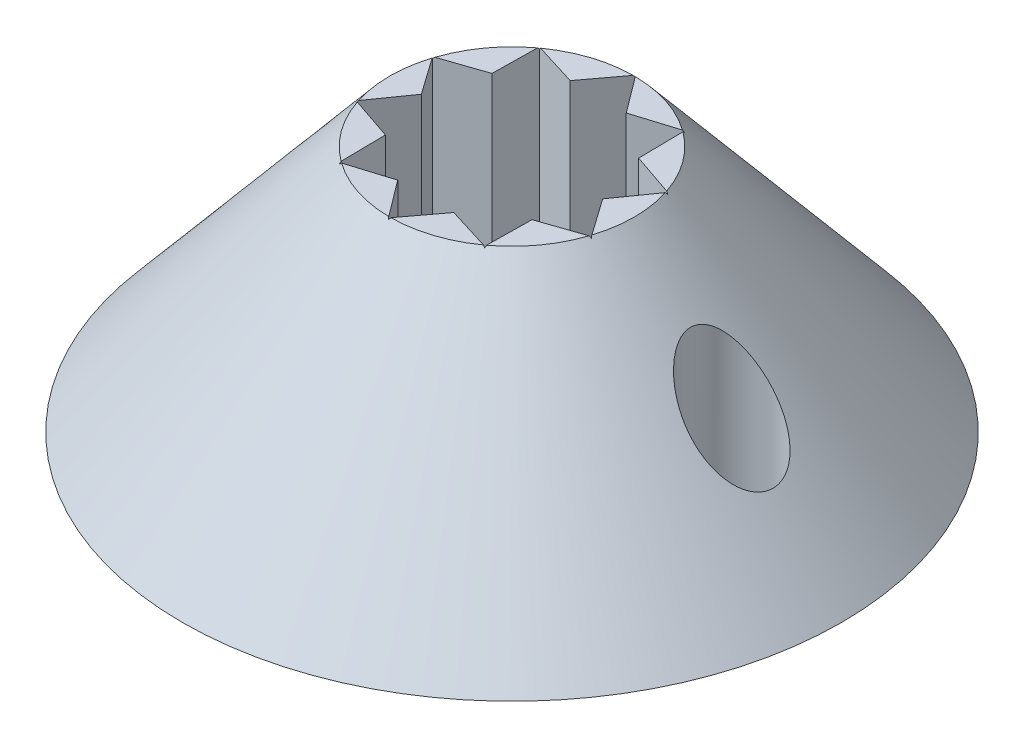
from build123d import *

# Parameters (mm, degrees)
SKETCH1_R           = 6
BOSS_EXTRUDE1_DEPTH = 4.5
BOSS_EXTRUDE1_TAPER = 40
CUT_EXTRUDE1_DEPTH  = 5
SKETCH5_R           = 0.75
CUT_EXTRUDE2_DEPTH  = 5


with BuildPart() as part:
    # Sketch1 → Boss-Extrude1 (new body)
    with BuildSketch(Plane(origin=(0, 0, 0), x_dir=(1, 0, 0), z_dir=(0, 1, 0))):
        Circle(SKETCH1_R)
    extrude(amount=BOSS_EXTRUDE1_DEPTH, taper=BOSS_EXTRUDE1_TAPER)

    # Sketch3 → Cut-Extrude1 (cut)
    with BuildSketch(Plane(origin=(0, 4.5, 0), x_dir=(1, 0, 0), z_dir=(0, 1, 0))):
        Polygon((0, 2.25), (-0.509878041, 1.569243252), (-1.322516818, 1.820288237), (-1.334878041, 0.969845666), (-2.139877162, 0.695288237), (-1.65, 0), (-2.139877162, -0.695288237), (-1.334878041, -0.969845666), (-1.322516818, -1.820288237), (-0.509878041, -1.569243252), (0, -2.25), (0.509878041, -1.569243252), (1.322516818, -1.820288237), (1.334878041, -0.969845666), (2.139877162, -0.695288237), (1.65, 0), (2.139877162, 0.695288237), (1.334878041, 0.969845666), (1.322516818, 1.820288237), (0.509878041, 1.569243252), align=None)
    extrude(amount=-CUT_EXTRUDE1_DEPTH, mode=Mode.SUBTRACT)

    # Sketch5 → Cut-Extrude2 (cut)
    with BuildSketch(Plane.XZ):
        with Locations(Location((4, 0, 0), (0, 0, 270))):
            Circle(SKETCH5_R)
        with Locations(Location((-4, 0, 0), (0, 0, 270))):
            Circle(SKETCH5_R)
    extrude(amount=-CUT_EXTRUDE2_DEPTH, mode=Mode.SUBTRACT)


solid = part.part
